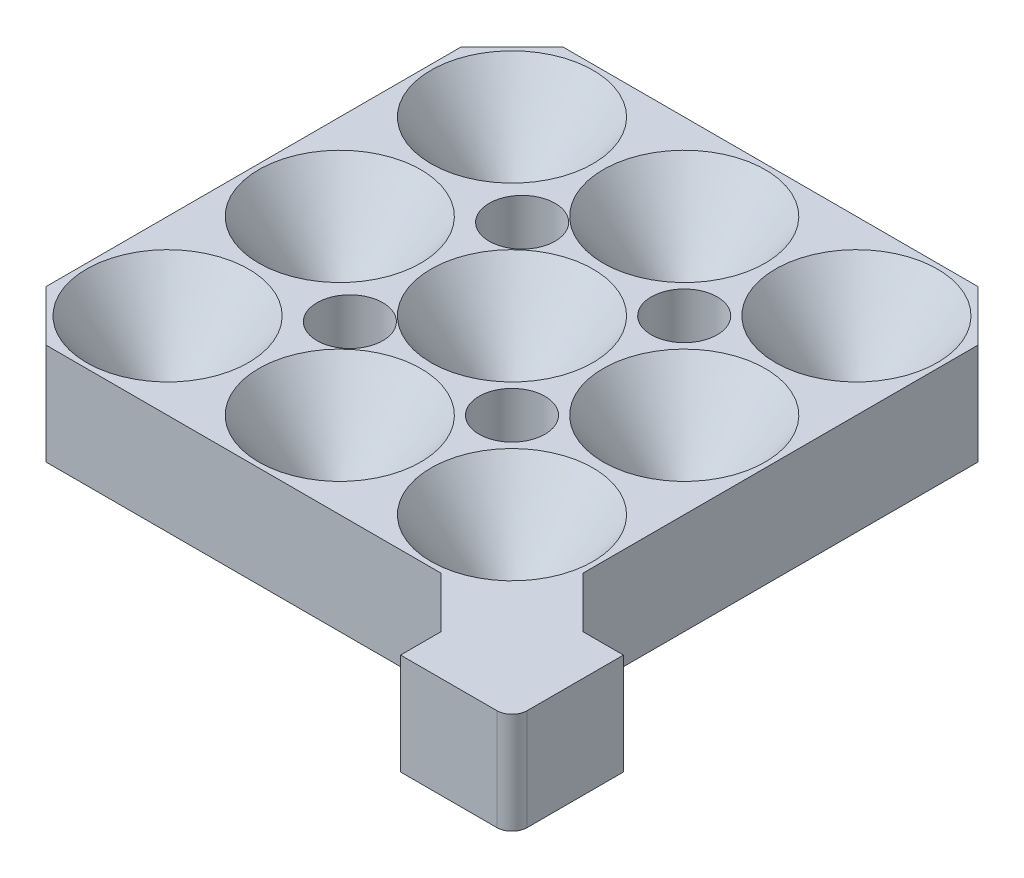
from build123d import *

# Parameters (mm, degrees)
SCHIZZO1_W                   = 120
SCHIZZO1_H                   = 120
ESTRUSIONE_ESTRUSIONE1_DEPTH = 20
SCHIZZO5_R                   = 5
TAGLIO_ESTRUSIONE2_DEPTH     = 87.168439698
RIPETIZIONE_A_L1_COUNT       = 3
RIPETIZIONE_A_L1_PITCH       = 34
RIPETIZIONE_A_L1_COUNT_DIR2  = 3
RIPETIZIONE_A_L1_PITCH_DIR2  = 34
SCHIZZO7_W                   = 98
SCHIZZO7_H                   = 18
SCHIZZO7_W_2                 = 18
SCHIZZO7_H_2                 = 98
TAGLIO_ESTRUSIONE3_DEPTH     = 20
SMUSSO1_SIZE                 = 10
SCHIZZO8_R                   = 6.5
TAGLIO_ESTRUSIONE4_DEPTH     = 20
RIPETIZIONE_A_L2_COUNT       = 2
RIPETIZIONE_A_L2_PITCH       = 34
RIPETIZIONE_A_L2_COUNT_DIR2  = 2
RIPETIZIONE_A_L2_PITCH_DIR2  = 32
RACCORDO1_R                  = 3


with BuildPart() as part:
    # Schizzo1 → Estrusione-Estrusione1 (new body)
    with BuildSketch(Plane(origin=(0, 0, 0), x_dir=(1, 0, 0), z_dir=(0, 1, 0))):
        Rectangle(SCHIZZO1_W, SCHIZZO1_H)
    extrude(amount=ESTRUSIONE_ESTRUSIONE1_DEPTH)

    # Schizzo6 → Taglia-Rivoluzione4 (revolve, cut)
    with BuildSketch(Plane.ZY.offset(43)):
        Polygon((-43, 20), (-27, 20), (-38, 5), (-43, 5), align=None)
    taglia_rivoluzione4 = revolve(axis=Axis((-43, 5, -43), (0, 1, 0)), mode=Mode.SUBTRACT)

    # Schizzo5 → Taglio-Estrusione2 (cut, symmetric)
    with BuildSketch(Plane(origin=(0, 5, 0), x_dir=(-1, 0, 0), z_dir=(0, -1, 0))):
        with Locations((43, 43)):
            Circle(SCHIZZO5_R)
    taglio_estrusione2 = extrude(amount=TAGLIO_ESTRUSIONE2_DEPTH, both=True, mode=Mode.SUBTRACT)

    # Ripetizione a L1: Taglia-Rivoluzione4, Taglio-Estrusione2 3 × 3
    with Locations(*[(i * RIPETIZIONE_A_L1_PITCH, 0, j * RIPETIZIONE_A_L1_PITCH_DIR2) for i in range(RIPETIZIONE_A_L1_COUNT) for j in range(RIPETIZIONE_A_L1_COUNT_DIR2) if (i, j) != (0, 0)]):
        add(taglia_rivoluzione4, mode=Mode.SUBTRACT)
        add(taglio_estrusione2, mode=Mode.SUBTRACT)

    # Schizzo7 → Taglio-Estrusione3 (cut)
    with BuildSketch(Plane(origin=(0, 20, 0), x_dir=(1, 0, 0), z_dir=(0, 1, 0))):
        with Locations((-11, -51)):
            Rectangle(SCHIZZO7_W, SCHIZZO7_H)
        with Locations((51, 11)):
            Rectangle(SCHIZZO7_W_2, SCHIZZO7_H_2)
    extrude(amount=-TAGLIO_ESTRUSIONE3_DEPTH, mode=Mode.SUBTRACT)

    # Smusso1
    smusso1_edges = [part.edges().sort_by_distance(p)[0] for p in [
        (-60, 10, 42),
        (-60, 10, -60),
        (42, 10, -60),
        (42, 10, 38),
        (38, 10, 42),
    ]]
    chamfer(smusso1_edges, length=SMUSSO1_SIZE)

    # Schizzo8 → Taglio-Estrusione4 (cut)
    with BuildSketch(Plane(origin=(0, 20, 0), x_dir=(1, 0, 0), z_dir=(0, 1, 0))):
        with Locations((8, -8)):
            Circle(SCHIZZO8_R)
    taglio_estrusione4 = extrude(amount=-TAGLIO_ESTRUSIONE4_DEPTH, mode=Mode.SUBTRACT)

    # Ripetizione a L2: Taglio-Estrusione4 2 × 2
    with Locations(*[(-j * RIPETIZIONE_A_L2_PITCH_DIR2, 0, -i * RIPETIZIONE_A_L2_PITCH) for i in range(RIPETIZIONE_A_L2_COUNT) for j in range(RIPETIZIONE_A_L2_COUNT_DIR2) if (i, j) != (0, 0)]):
        add(taglio_estrusione4, mode=Mode.SUBTRACT)

    # Raccordo1
    raccordo1_edges = [part.edges().sort_by_distance(p)[0] for p in [
        (60, 10, 60),
    ]]
    fillet(raccordo1_edges, radius=RACCORDO1_R)


solid = part.part
